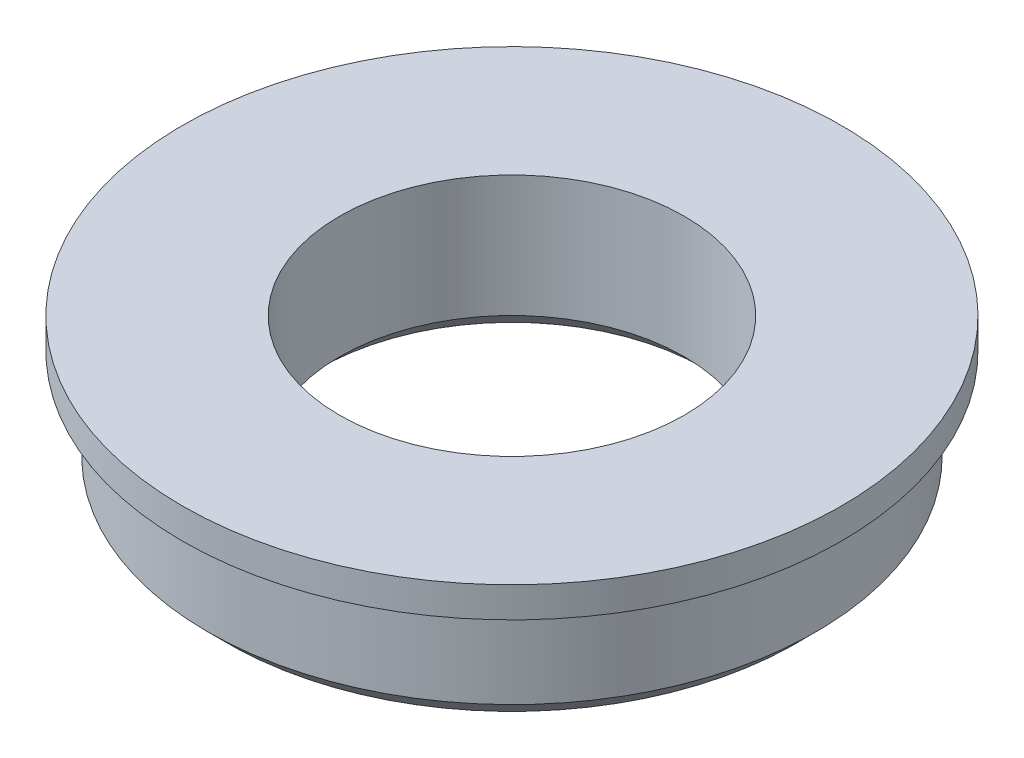
from build123d import *

# Parameters (mm, degrees)
CHAMFER_1_SIZE = 1


with BuildPart() as part:
    # 草图1 → 旋转1 (revolve)
    with BuildSketch(Plane.XY, mode=Mode.PRIVATE) as revolve_1_sk:
        Polygon((-8.5, 0), (-15, 0), (-15, 5.5), (-16.25, 5.5), (-16.25, 7), (-8.5, 7), align=None)
    revolve(revolve_1_sk.sketch.rotate(Axis((0, 46.229753092, 0), (0, -1, 0)), 270), axis=Axis((0, 46.229753092, 0), (0, -1, 0)))

    # 倒角1
    chamfer_1_edges = [part.edges().sort_by_distance(p)[0] for p in [
        (0, 0, -15),
        (0, 0, -8.5),
    ]]
    chamfer(chamfer_1_edges, length=CHAMFER_1_SIZE)


solid = part.part
